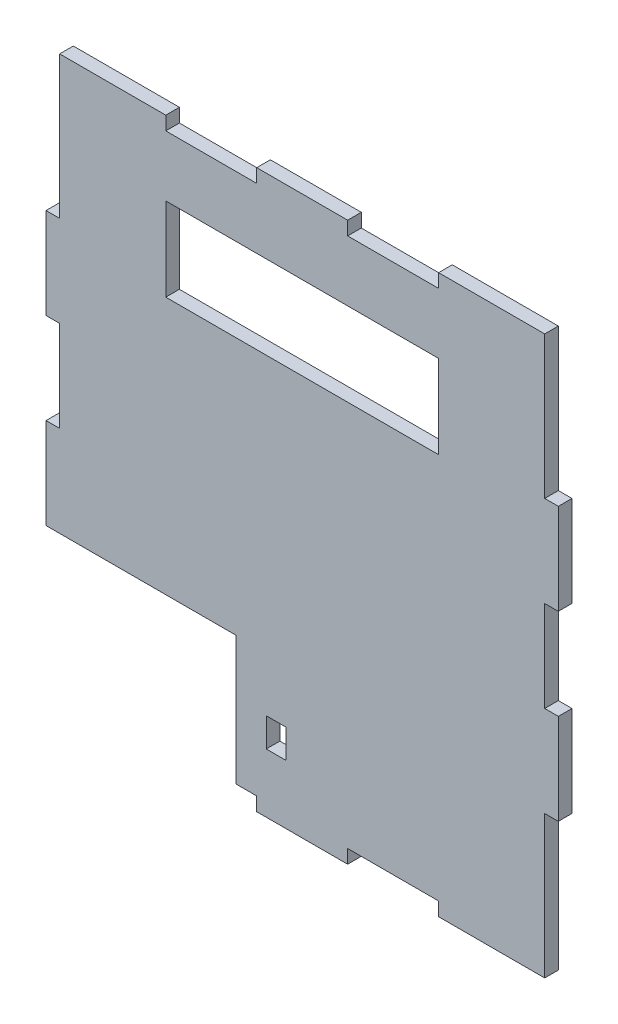
from build123d import *

# Parameters (mm, degrees)
BOSS_EXTRUDE1_DEPTH = 9
SKETCH2_W           = 74.887018594
SKETCH2_H           = 25.704308128
CUT_EXTRUDE1_DEPTH  = 10
SKETCH3_W           = 13
SKETCH3_H           = 19
CUT_EXTRUDE2_DEPTH  = 10
SKETCH4_W           = 180
SKETCH4_H           = 55
CUT_EXTRUDE3_DEPTH  = 478.310586352


with BuildPart() as part:
    # Sketch1 → Boss-Extrude1 (new body)
    with BuildSketch(Plane.XY):
        Polygon((169.032702555, 364.5), (109.032702555, 364.5), (109.032702555, 355.5), (49.032702555, 355.5), (49.032702555, 364.5), (-20.967297445, 364.5), (-20.967297445, 270.5), (-29.967297445, 270.5), (-29.967297445, 210.5), (-20.967297445, 210.5), (-20.967297445, 150.5), (-29.967297445, 150.5), (-29.967297445, 90.5), (-20.967297445, 90.5), (-20.967297445, -3.5), (49.032702555, -3.5), (49.032702555, 5.5), (109.032702555, 5.5), (109.032702555, -3.5), (169.032702555, -3.5), (169.032702555, 5.5), (229.032702555, 5.5), (229.032702555, -3.5), (299.032702555, -3.5), (299.032702555, 90.5), (308.032702555, 90.5), (308.032702555, 150.5), (299.032702555, 150.5), (299.032702555, 210.5), (308.032702555, 210.5), (308.032702555, 270.5), (299.032702555, 270.5), (299.032702555, 364.5), (229.032702555, 364.5), (229.032702555, 355.5), (169.032702555, 355.5), align=None)
    extrude(amount=BOSS_EXTRUDE1_DEPTH)

    # Sketch2 → Cut-Extrude1 (cut)
    with BuildSketch(Plane(origin=(0, 0, 0), x_dir=(-1, 0, 0), z_dir=(0, 0, -1))):
        Polygon((20.967297445, 90.5), (-95.329165796, 90.5), (-95.329165796, 5.5), (9.317508813, 5.5), (29.967297445, 5.5), (29.967297445, 90.5), align=None)
        with Locations((-14.280157362, -7.352154064)):
            Rectangle(SKETCH2_W, SKETCH2_H)
    extrude(amount=-CUT_EXTRUDE1_DEPTH, mode=Mode.SUBTRACT)

    # Sketch3 → Cut-Extrude2 (cut)
    with BuildSketch(Plane(origin=(0, 0, 0), x_dir=(-1, 0, 0), z_dir=(0, 0, -1))):
        with Locations((-121.829165796, 45)):
            Rectangle(SKETCH3_W, SKETCH3_H)
    extrude(amount=-CUT_EXTRUDE2_DEPTH, mode=Mode.SUBTRACT)

    # Sketch4 → Cut-Extrude3 (cut, through all)
    with BuildSketch(Plane(origin=(0, 0, 0), x_dir=(-1, 0, 0), z_dir=(0, 0, -1))):
        with Locations((-139.032702555, 288)):
            Rectangle(SKETCH4_W, SKETCH4_H)
    extrude(amount=-CUT_EXTRUDE3_DEPTH, mode=Mode.SUBTRACT)


solid = part.part
